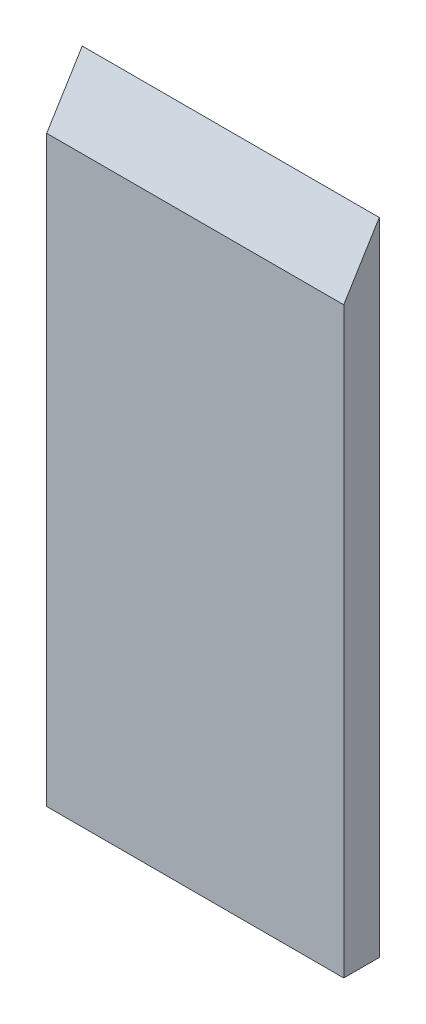
from build123d import *

# Parameters (mm, degrees)
CROQUIS1_W              = 359.5
CROQUIS1_H              = 43
SALIENTE_EXTRUIR1_DEPTH = 775.633
CORTAR_EXTRUIR1_DEPTH   = 360


with BuildPart() as part:
    # Croquis1 → Saliente-Extruir1 (new body)
    with BuildSketch(Plane(origin=(0, 0, 0), x_dir=(1, 0, 0), z_dir=(0, 1, 0))):
        with Locations((10.328125, 23.177734375)):
            Rectangle(CROQUIS1_W, CROQUIS1_H)
    extrude(amount=SALIENTE_EXTRUIR1_DEPTH)

    # Croquis5 → Cortar-Extruir1 (cut)
    with BuildSketch(Plane(origin=(190.078125, 0, 0), x_dir=(0, 0, -1), z_dir=(1, 0, 0))):
        Polygon((44.677734375, 775.633), (1.677734375, 705.63755904), (1.677734375, 775.633), align=None)
    extrude(amount=-CORTAR_EXTRUIR1_DEPTH, mode=Mode.SUBTRACT)


solid = part.part
